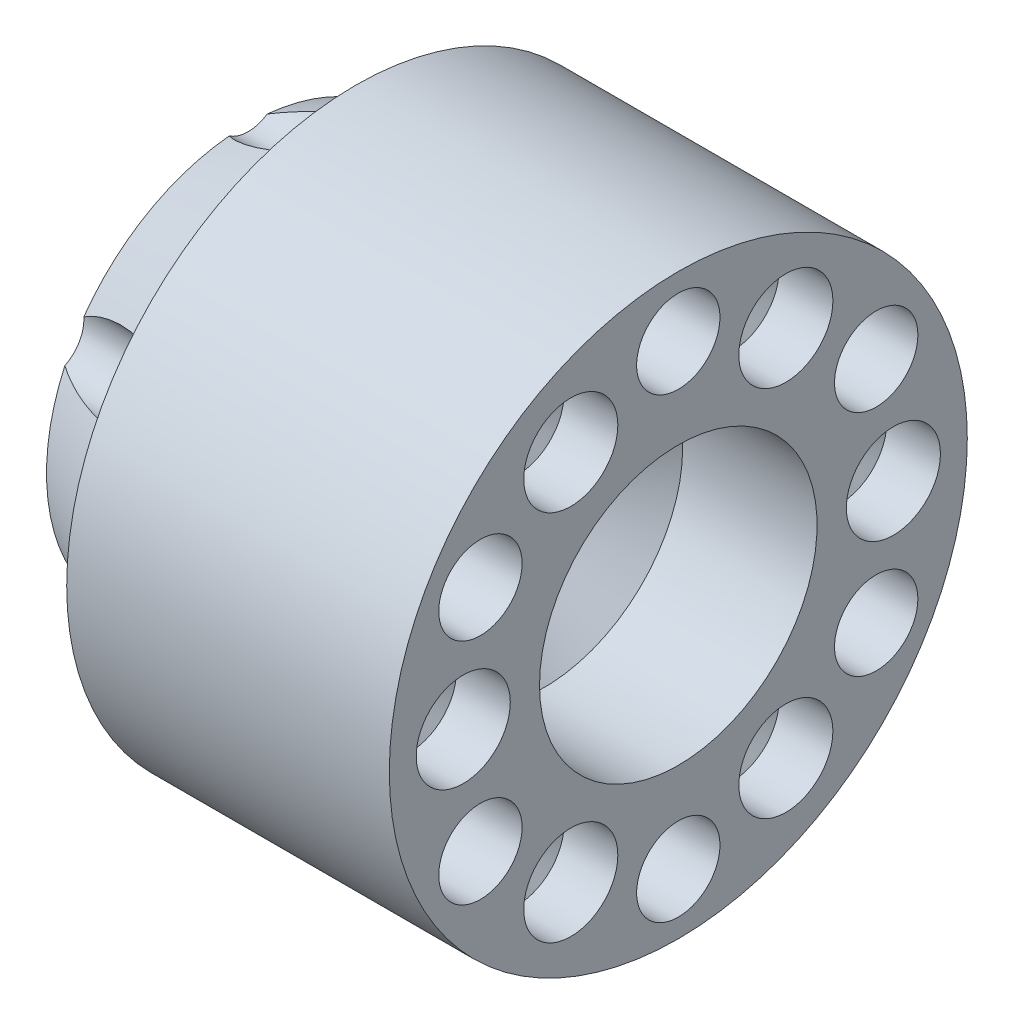
from build123d import *

# Parameters (mm, degrees)
SKETCH11_R                   = 3.1
EXTRUDE1_DEPTH               = 12
M6_TAPPED_HOLE1_D            = 5
M6_TAPPED_HOLE1_DEPTH        = 35
M6_TAPPED_HOLE1_TIP          = 1.502151548
F_7_0_7_DIAMETER_HOLE1_D     = 7
F_7_0_7_DIAMETER_HOLE1_DEPTH = 4
F_7_0_7_DIAMETER_HOLE1_TIP   = 2.103012167
EXTRUDE3_DEPTH               = 1


with BuildPart() as part:
    # Sketch1 → Revolve1 (revolve)
    with BuildSketch(Plane.XY, mode=Mode.PRIVATE) as revolve1_sk:
        Polygon((8, 18.5), (0, 15), (0, 8.3175), (18.175, 6.5), (22, 10.325), (32, 10.325), (32, 21.5), (8, 21.5), align=None)
    revolve(revolve1_sk.sketch.rotate(Axis((0, 0, 0), (1, 0, 0)), 90), axis=Axis((0, 0, 0), (1, 0, 0)))

    # Sketch11 → Extrude1 (cut)
    with BuildSketch(Plane(origin=(32, 0, 0), x_dir=(0, 0, -1), z_dir=(1, 0, 0))):
        with Locations((0, -17)):
            Circle(SKETCH11_R)
        with Locations((-14.722431864, -8.5)):
            Circle(SKETCH11_R)
        with Locations((-14.722431864, 8.5)):
            Circle(SKETCH11_R)
        with Locations((0, 17)):
            Circle(SKETCH11_R)
        with Locations((14.722431864, 8.5)):
            Circle(SKETCH11_R)
        with Locations((14.722431864, -8.5)):
            Circle(SKETCH11_R)
    extrude(amount=-EXTRUDE1_DEPTH, mode=Mode.SUBTRACT)

    # M6 Tapped Hole1
    with Locations(Plane(origin=(20, -17, 0), x_dir=(0, 0, 1), z_dir=(1, 0, 0))):
        with Locations((0, 0), (14.722431864, -8.5), (14.722431864, -25.5), (0, -34), (-14.722431864, -25.5), (-14.722431864, -8.5)):
            Hole(M6_TAPPED_HOLE1_D / 2, depth=M6_TAPPED_HOLE1_DEPTH)
            with Locations((0, 0, -(M6_TAPPED_HOLE1_DEPTH + M6_TAPPED_HOLE1_TIP / 2))):  # 118° drill point
                Cone(0, M6_TAPPED_HOLE1_D / 2, M6_TAPPED_HOLE1_TIP, mode=Mode.SUBTRACT)

    # Ø7.0 (7) Diameter Hole1
    with Locations(Plane(origin=(32, -13.856406461, -8), x_dir=(0, 0, 1), z_dir=(1, 0, 0))):
        with Locations((0, 0), (16, 0), (24, -13.856406461), (16, -27.712812922), (0, -27.712812922), (-8, -13.856406461)):
            Hole(F_7_0_7_DIAMETER_HOLE1_D / 2, depth=F_7_0_7_DIAMETER_HOLE1_DEPTH)
            with Locations((0, 0, -(F_7_0_7_DIAMETER_HOLE1_DEPTH + F_7_0_7_DIAMETER_HOLE1_TIP / 2))):  # 118° drill point
                Cone(0, F_7_0_7_DIAMETER_HOLE1_D / 2, F_7_0_7_DIAMETER_HOLE1_TIP, mode=Mode.SUBTRACT)

    # Sketch18 → Extrude3 (cut, symmetric)
    with BuildSketch(Plane.XY):
        Polygon((21.070558224, 5.305955372), (-1.084590537, 7.521470248), (-0.78607938, 10.506581818), (21.369069381, 8.291066942), align=None)
    extrude(amount=EXTRUDE3_DEPTH, both=True, mode=Mode.SUBTRACT)


solid = part.part
